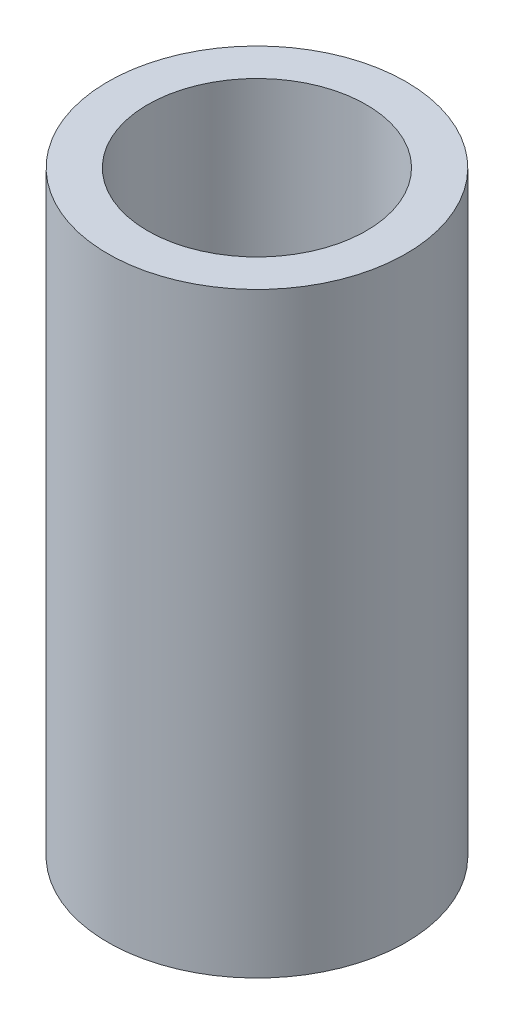
from build123d import *

# Parameters (mm, degrees)
SKETCH1_R           = 9.525
BOSS_EXTRUDE1_DEPTH = 38.1
SKETCH2_R           = 6.985
CUT_EXTRUDE1_DEPTH  = 36.83


with BuildPart() as part:
    # Sketch1 → Boss-Extrude1 (new body)
    with BuildSketch(Plane(origin=(0, 0, 0), x_dir=(1, 0, 0), z_dir=(0, 1, 0))):
        with Locations(Location((0, 0, 0), (0, 0, 90))):
            Circle(SKETCH1_R)
    extrude(amount=BOSS_EXTRUDE1_DEPTH)

    # Sketch2 → Cut-Extrude1 (cut)
    with BuildSketch(Plane(origin=(0, 38.1, 0), x_dir=(1, 0, 0), z_dir=(0, 1, 0))):
        with Locations(Location((0, 0, 0), (0, 0, 270))):
            Circle(SKETCH2_R)
    extrude(amount=-CUT_EXTRUDE1_DEPTH, mode=Mode.SUBTRACT)


solid = part.part
